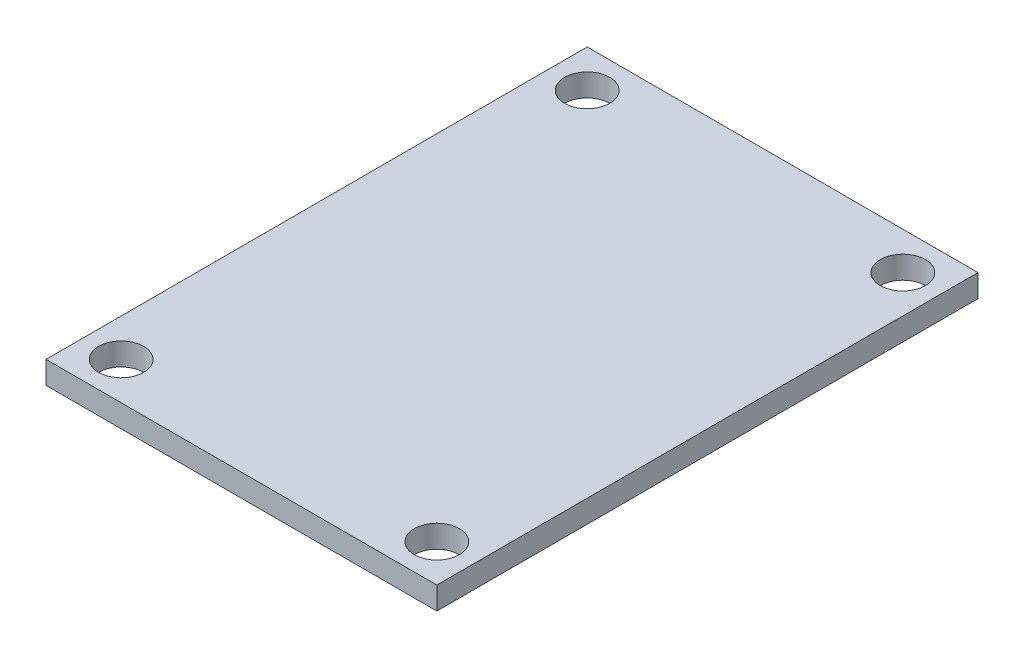
from build123d import *

# Parameters (mm, degrees)
SKETCH1_W           = 26
SKETCH1_H           = 36
BOSS_EXTRUDE1_DEPTH = 1.5
SKETCH2_R           = 1.5
CUT_EXTRUDE1_DEPTH  = 1.5
SKETCH5_W           = 15
SKETCH5_H           = 11.5
BOSS_EXTRUDE4_DEPTH = 2.5
SKETCH6_W           = 1.833556109
SKETCH6_H           = 1.290280226
SKETCH6_W_2         = 1.969375081
SKETCH6_W_3         = 1.697737138
SKETCH6_W_4         = 1.561918168
BOSS_EXTRUDE5_DEPTH = 1.5
FILLET1_R           = 0.5
CUT_EXTRUDE2_DEPTH  = 0.5


with BuildPart() as part:
    # Sketch1 → Boss-Extrude1 (new body)
    with BuildSketch(Plane(origin=(0, 0, 0), x_dir=(1, 0, 0), z_dir=(0, 1, 0))):
        Rectangle(SKETCH1_W, SKETCH1_H)
    extrude(amount=BOSS_EXTRUDE1_DEPTH)

    # Sketch2 → Cut-Extrude1 (cut)
    with BuildSketch(Plane(origin=(0, 1.5, 0), x_dir=(1, 0, 0), z_dir=(0, 1, 0))):
        with Locations((-10.5, 15.5)):
            Circle(SKETCH2_R)
        with Locations((10.5, 15.5)):
            Circle(SKETCH2_R)
        with Locations((10.5, -15.5)):
            Circle(SKETCH2_R)
        with Locations((-10.5, -15.5)):
            Circle(SKETCH2_R)
    extrude(amount=-CUT_EXTRUDE1_DEPTH, mode=Mode.SUBTRACT)

    # Sketch5 → Boss-Extrude4 (add)
    with BuildSketch(Plane.XZ):
        with Locations((0, 0.75)):
            Rectangle(SKETCH5_W, SKETCH5_H)
    extrude(amount=BOSS_EXTRUDE4_DEPTH)

    # Sketch6 → Boss-Extrude5 (add)
    with BuildSketch(Plane.XZ):
        with Locations((1.078775567, -11.02953631)):
            Rectangle(SKETCH6_W, SKETCH6_H)
        with Locations((3.455607561, -11.02953631)):
            Rectangle(SKETCH6_W_2, SKETCH6_H)
        with Locations((5.832439554, -11.02953631)):
            Rectangle(SKETCH6_W_3, SKETCH6_H)
        with Locations((8.039497834, -11.02953631)):
            Rectangle(SKETCH6_W_4, SKETCH6_H)
    extrude(amount=BOSS_EXTRUDE5_DEPTH)

    # Fillet1
    fillet1_edges = [part.edges().sort_by_distance(p)[0] for p in [
        (0, -2.5, -5),
        (-7.5, -2.5, 0.75),
        (0, -2.5, 6.5),
        (7.5, -2.5, 0.75),
    ]]
    fillet(fillet1_edges, radius=FILLET1_R)

    # Sketch7 → Cut-Extrude2 (cut)
    # profile 1 of 3: a face of its own
    with BuildSketch(Plane.XZ.offset(2.5)):
        with BuildLine():
            Line((-0.95224416, 1.042060188), (-1.221474929, 0.786851855))
            add(Edge.make_bspline(
                [(-1.221474929, 0.786851855), (-1.270193817, 0.832682718), (-1.366469864, 0.923251581), (-1.523430107, 1.040762576), (-1.687193741, 1.141428676), (-1.856906237, 1.223334912), (-2.028364791, 1.288687673), (-2.199293568, 1.335215813), (-2.367939269, 1.364888351), (-2.480106487, 1.36843672), (-2.535377173, 1.370185188)],
                knots=[0, 0, 0, 0, 1.08915593, 2.152340314, 3.188132944, 4.216796309, 5.218260357, 6.173443236, 7.099959455, 8, 8, 8, 8], degree=3))
            add(Edge.make_bspline(
                [(-2.535377173, 1.370185188), (-2.569291873, 1.369771582), (-2.637033313, 1.368945443), (-2.737655257, 1.358401228), (-2.837221894, 1.343236364), (-2.935545269, 1.321294486), (-3.032816556, 1.293485427), (-3.128697448, 1.258699963), (-3.223366803, 1.218144719), (-3.315932884, 1.171282245), (-3.405673387, 1.119802399), (-3.490430223, 1.062753858), (-3.570743622, 1.001965068), (-3.645104047, 0.935914089), (-3.713939234, 0.865199224), (-3.778887606, 0.791135918), (-3.837664901, 0.711700699), (-3.890756066, 0.628355073), (-3.938117685, 0.542562884), (-3.979926338, 0.455149894), (-4.015023426, 0.36640604), (-4.042792882, 0.276219962), (-4.065703536, 0.185289372), (-4.081821143, 0.092984652), (-4.090907865, -0.000793034), (-4.092479645, -0.063590292), (-4.093269801, -0.095159363)],
                knots=[0, 0, 0, 0, 1.02818874, 2.053710826, 3.065248034, 4.081641283, 5.106893873, 6.131558223, 7.173050175, 8.228653731, 9.27666206, 10.308777013, 11.325269123, 12.329503258, 13.32196095, 14.316845687, 15.314881793, 16.315733098, 17.311955233, 18.285320748, 19.252783886, 20.203351036, 21.145449891, 22.095197417, 23.042428769, 24, 24, 24, 24], degree=3))
            add(Edge.make_bspline(
                [(-4.093269801, -0.095159363), (-4.092514083, -0.12743018), (-4.09100471, -0.191883694), (-4.08134439, -0.288077767), (-4.06341615, -0.382843169), (-4.039448441, -0.476491302), (-4.009467625, -0.56918255), (-3.972094959, -0.66051506), (-3.927829359, -0.750485451), (-3.876592807, -0.838283068), (-3.820406603, -0.923806091), (-3.757463522, -1.004365613), (-3.690602939, -1.08103439), (-3.617389039, -1.152110154), (-3.540169497, -1.21949405), (-3.456637221, -1.281329572), (-3.36843476, -1.338807796), (-3.275427548, -1.391204315), (-3.178624766, -1.438012851), (-3.079368013, -1.479636747), (-2.977340197, -1.513916084), (-2.873077508, -1.541854188), (-2.766704236, -1.564754485), (-2.657680433, -1.579486966), (-2.546807725, -1.590177797), (-2.472069093, -1.590959467), (-2.434415634, -1.591353273)],
                knots=[0, 0, 0, 0, 0.93586088, 1.869166235, 2.799637598, 3.729985548, 4.670839027, 5.622275134, 6.589130586, 7.576015415, 8.568469353, 9.55398029, 10.53834874, 11.515998671, 12.510579167, 13.508179873, 14.527009472, 15.561807829, 16.601455013, 17.643573243, 18.680854198, 19.719860599, 20.772568776, 21.833555941, 22.908541556, 24, 24, 24, 24], degree=3))
            add(Edge.make_bspline(
                [(-2.434415634, -1.591353273), (-2.389037287, -1.590404697), (-2.29992953, -1.588542013), (-2.168943087, -1.574041724), (-2.043140016, -1.55139493), (-1.922873813, -1.518229034), (-1.808004792, -1.475925359), (-1.698111851, -1.424929972), (-1.594060192, -1.363286913), (-1.495537019, -1.293713046), (-1.404779833, -1.216198214), (-1.322925709, -1.132553758), (-1.25128022, -1.043185692), (-1.188775521, -0.948620376), (-1.137066867, -0.848075071), (-1.094624071, -0.742042509), (-1.06209078, -0.630474997), (-1.048735805, -0.553383365), (-1.04198775, -0.514430197)],
                knots=[0, 0, 0, 0, 1.13008108, 2.219097802, 3.278683437, 4.311054135, 5.322181354, 6.324827112, 7.324222904, 8.330512327, 9.32562643, 10.293043162, 11.24128371, 12.174520618, 13.111833804, 14.052305215, 15.015860969, 16, 16, 16, 16], degree=3))
            Line((-1.04198775, -0.514430197), (-2.208654416, -0.514430197))
            Line((-2.208654416, -0.514430197), (-2.208654416, -0.155455838))
            Line((-2.208654416, -0.155455838), (-0.727885186, -0.155455838))
            add(Edge.make_bspline(
                [(-0.727885186, -0.155455838), (-0.729591034, -0.222363326), (-0.732929687, -0.353313368), (-0.756348603, -0.544283639), (-0.794165115, -0.724655332), (-0.845825427, -0.894618404), (-0.912700708, -1.053931997), (-0.994073236, -1.202757863), (-1.091245357, -1.340134544), (-1.200755799, -1.467183547), (-1.323655756, -1.58051276), (-1.456624376, -1.680118697), (-1.599881345, -1.764021313), (-1.753291152, -1.832281975), (-1.916351586, -1.88555597), (-2.089439965, -1.923327547), (-2.272321566, -1.94595751), (-2.397658243, -1.94884889), (-2.461759384, -1.950327632)],
                knots=[0, 0, 0, 0, 1.140356446, 2.231883559, 3.274166699, 4.278491846, 5.25512956, 6.21435461, 7.1637429, 8.11826594, 9.068280886, 10.0076534, 10.945064095, 11.891975133, 12.864533718, 13.863980011, 14.907571808, 16, 16, 16, 16], degree=3))
            add(Edge.make_bspline(
                [(-2.461759384, -1.950327632), (-2.50126952, -1.949758511), (-2.579196241, -1.948636021), (-2.694287169, -1.940658673), (-2.806204789, -1.928378097), (-2.914932798, -1.909832974), (-3.02087114, -1.887118319), (-3.123490725, -1.858031601), (-3.223182467, -1.824362901), (-3.320100453, -1.786067228), (-3.413365, -1.741695571), (-3.503391517, -1.692385932), (-3.590677642, -1.638392571), (-3.674628807, -1.578781725), (-3.755682429, -1.513999265), (-3.833315872, -1.443915346), (-3.907963751, -1.368744226), (-3.954724214, -1.315365217), (-3.978285827, -1.288468658)],
                knots=[0, 0, 0, 0, 1.107784379, 2.184907829, 3.233506516, 4.263428166, 5.276301166, 6.270063455, 7.25232949, 8.225834625, 9.190232166, 10.146266622, 11.1027726, 12.066435141, 13.031522626, 14.010570082, 14.99756817, 16, 16, 16, 16], degree=3))
            add(Edge.make_bspline(
                [(-3.978285827, -1.288468658), (-4.012471759, -1.245798005), (-4.080276171, -1.161164988), (-4.167554328, -1.025565043), (-4.241955731, -0.885163183), (-4.302323553, -0.739568555), (-4.349461639, -0.588917342), (-4.383267892, -0.433402051), (-4.403075181, -0.27282242), (-4.405928719, -0.164157156), (-4.407372365, -0.109181799)],
                knots=[0, 0, 0, 0, 1.023165419, 2.029347347, 3.013907458, 3.994755782, 4.975994455, 5.96558838, 6.970761222, 8, 8, 8, 8], degree=3))
            add(Edge.make_bspline(
                [(-4.407372365, -0.109181799), (-4.406840127, -0.068015546), (-4.405782415, 0.013793761), (-4.392956899, 0.135251068), (-4.374555481, 0.254551761), (-4.347508426, 0.371598317), (-4.313412162, 0.486468909), (-4.270858676, 0.599216873), (-4.22131378, 0.709908744), (-4.163728284, 0.817782612), (-4.099643824, 0.921407025), (-4.030093604, 1.020364828), (-3.954090003, 1.112853893), (-3.872874204, 1.200045542), (-3.785477214, 1.280844389), (-3.69271779, 1.355998499), (-3.594524447, 1.425608685), (-3.490588267, 1.48857852), (-3.382460583, 1.54514214), (-3.270400581, 1.594731352), (-3.15444247, 1.635714667), (-3.035454993, 1.670488447), (-2.912537492, 1.696203588), (-2.786581955, 1.714852333), (-2.656931843, 1.727612933), (-2.569295814, 1.728639188), (-2.524860346, 1.729159547)],
                knots=[0, 0, 0, 0, 1.008945113, 2.00506715, 2.99143336, 3.967273523, 4.948097931, 5.927297278, 6.919902385, 7.919676788, 8.923139349, 9.905703106, 10.883022732, 11.856032218, 12.825136022, 13.798837087, 14.781400844, 15.773989409, 16.776158564, 17.77167057, 18.775803737, 19.789618931, 20.80898985, 21.851988756, 22.910860228, 24, 24, 24, 24], degree=3))
            add(Edge.make_bspline(
                [(-2.524860346, 1.729159547), (-2.488622102, 1.728580055), (-2.416765923, 1.727430991), (-2.309840191, 1.719466343), (-2.204567177, 1.706842462), (-2.100790787, 1.689615675), (-1.99886442, 1.666151985), (-1.898497715, 1.6380737), (-1.799545179, 1.605381878), (-1.70231693, 1.566393031), (-1.606159214, 1.522139406), (-1.510537373, 1.472325984), (-1.415778127, 1.416100979), (-1.321717146, 1.353297444), (-1.227761288, 1.284994026), (-1.135396645, 1.209237202), (-1.042393701, 1.129014447), (-0.982591887, 1.071332263), (-0.95224416, 1.042060188)],
                knots=[0, 0, 0, 0, 0.985871117, 1.954866573, 2.915460327, 3.869826059, 4.81536089, 5.759505086, 6.70452669, 7.649098992, 8.607881297, 9.583363685, 10.581137262, 11.603961102, 12.659522466, 13.73993555, 14.853081303, 16, 16, 16, 16], degree=3))
        make_face()
    # profile 2 of 3: a face of its own
    with BuildSketch(Plane.XZ.offset(2.5)):
        with BuildLine():
            Line((-0.009936468, 1.639415957), (0.676461769, 1.639415957))
            add(Edge.make_bspline(
                [(0.676461769, 1.639415957), (0.723672676, 1.639364061), (0.814130868, 1.639264626), (0.943845924, 1.63624988), (1.061655656, 1.632223188), (1.167306037, 1.626641294), (1.261122135, 1.620044704), (1.342679434, 1.610792665), (1.412618991, 1.601132369), (1.45452544, 1.591310963), (1.47363725, 1.586831823)],
                knots=[0, 0, 0, 0, 1.415646017, 2.712440637, 3.8905458, 4.950247383, 5.884950622, 6.709939814, 7.411656543, 8, 8, 8, 8], degree=3))
            add(Edge.make_bspline(
                [(1.47363725, 1.586831823), (1.497830784, 1.580209873), (1.545647761, 1.567122011), (1.614548804, 1.540908288), (1.68010265, 1.509826123), (1.742534208, 1.474402183), (1.801076291, 1.433116618), (1.856602332, 1.387643001), (1.908622313, 1.336931432), (1.956843705, 1.281550692), (2.001128502, 1.222430482), (2.039258185, 1.158688253), (2.071185412, 1.091396949), (2.098568683, 1.020603378), (2.118277138, 0.945713054), (2.133124038, 0.867246342), (2.142547665, 0.785211652), (2.143450227, 0.729151784), (2.143909686, 0.700613874)],
                knots=[0, 0, 0, 0, 0.999701418, 1.975846123, 2.934577507, 3.890451536, 4.834027766, 5.787354733, 6.749476667, 7.726910423, 8.712836071, 9.690891519, 10.682875813, 11.679750201, 12.712814741, 13.765529915, 14.8625177, 16, 16, 16, 16], degree=3))
            add(Edge.make_bspline(
                [(2.143909686, 0.700613874), (2.143488261, 0.671836097), (2.142663715, 0.615530433), (2.13276743, 0.533157645), (2.119437239, 0.454439255), (2.098940186, 0.379549804), (2.072094513, 0.308934034), (2.04060246, 0.241512802), (2.00261893, 0.17843313), (1.9589741, 0.119466013), (1.910422506, 0.0645561), (1.857169568, 0.014101306), (1.799430275, -0.031603033), (1.737388127, -0.072659376), (1.670438278, -0.108115656), (1.599596125, -0.139872961), (1.524245908, -0.166544021), (1.472103394, -0.180574083), (1.445592378, -0.18770744)],
                knots=[0, 0, 0, 0, 1.121902311, 2.195077645, 3.232258892, 4.234102512, 5.217864754, 6.176164875, 7.132989551, 8.084763148, 9.034132444, 9.988522005, 10.94243251, 11.903244335, 12.886203696, 13.894208494, 14.929344452, 16, 16, 16, 16], degree=3))
            add(Edge.make_bspline(
                [(1.445592378, -0.18770744), (1.423665044, -0.192370421), (1.375610017, -0.202589615), (1.296467295, -0.213998072), (1.204321909, -0.223735673), (1.099299629, -0.23103681), (0.981494724, -0.237287179), (0.850843467, -0.242255273), (0.70708939, -0.244985127), (0.606818146, -0.245125919), (0.554466577, -0.245199427)],
                knots=[0, 0, 0, 0, 0.601384939, 1.31797006, 2.144135048, 3.087295005, 4.142315834, 5.309527816, 6.595305764, 8, 8, 8, 8], degree=3))
            Line((0.554466577, -0.245199427), (0.304166096, -0.245199427))
            Line((0.304166096, -0.245199427), (0.304166096, -1.860584043))
            Line((0.304166096, -1.860584043), (-0.009936468, -1.860584043))
            Line((-0.009936468, -1.860584043), (-0.009936468, 1.639415957))
        make_face()
        with BuildLine():
            Line((0.304166096, 1.280441598), (0.304166096, 0.113774932))
            Line((0.304166096, 0.113774932), (0.916946545, 0.106062592))
            add(Edge.make_bspline(
                [(0.916946545, 0.106062592), (0.946866471, 0.106047128), (1.004626271, 0.106017276), (1.088062494, 0.1100025), (1.165471781, 0.114603032), (1.236616357, 0.121338956), (1.301528291, 0.130860213), (1.36031582, 0.140471951), (1.412523103, 0.154377314), (1.473622305, 0.173100383), (1.541705652, 0.205032999), (1.615773201, 0.251382889), (1.678543787, 0.310463597), (1.732862084, 0.376891428), (1.775967962, 0.450790558), (1.807523954, 0.529859494), (1.826065112, 0.613287344), (1.828551305, 0.670375483), (1.829807122, 0.69921163)],
                knots=[0, 0, 0, 0, 1.160613943, 2.240541288, 3.23993089, 4.169200891, 5.011653406, 5.7853311, 6.478053781, 7.106038997, 8.262395093, 9.384106736, 10.481365981, 11.59014053, 12.70357646, 13.786202915, 14.881775077, 16, 16, 16, 16], degree=3))
            add(Edge.make_bspline(
                [(1.829807122, 0.69921163), (1.828544476, 0.727350144), (1.826034491, 0.783286026), (1.807378627, 0.865264787), (1.776029314, 0.943500491), (1.732572719, 1.016473576), (1.679831589, 1.08266238), (1.618532246, 1.140159507), (1.548818985, 1.18638121), (1.483970754, 1.216214492), (1.426369568, 1.234429767), (1.376337608, 1.247174608), (1.319846933, 1.257350214), (1.256879154, 1.265589717), (1.18792232, 1.272643178), (1.112384005, 1.277429155), (1.030550362, 1.280230611), (0.973739791, 1.280369567), (0.944290295, 1.280441598)],
                knots=[0, 0, 0, 0, 1.120700087, 2.227813068, 3.331159281, 4.466773991, 5.599788987, 6.693661531, 7.80175334, 8.91857717, 9.525282508, 10.207424825, 10.974604443, 11.810962634, 12.737642355, 13.736264703, 14.826523623, 16, 16, 16, 16], degree=3))
            Line((0.944290295, 1.280441598), (0.304166096, 1.280441598))
        make_face(mode=Mode.SUBTRACT)
    # profile 3 of 3: a face of its own
    with BuildSketch(Plane.XZ.offset(2.5)):
        with BuildLine():
            Line((2.502884045, -1.185403754), (2.798757443, -1.00801994))
            add(Edge.make_bspline(
                [(2.798757443, -1.00801994), (2.82627568, -1.054084325), (2.87899956, -1.142341909), (2.96695092, -1.261599949), (3.058083831, -1.362962106), (3.153073164, -1.445838714), (3.251339112, -1.5110876), (3.353523166, -1.557289832), (3.459280977, -1.586105808), (3.531254798, -1.589605894), (3.56718693, -1.591353273)],
                knots=[0, 0, 0, 0, 1.272034388, 2.437168799, 3.508375237, 4.49857839, 5.41946034, 6.295179144, 7.148887113, 8, 8, 8, 8], degree=3))
            add(Edge.make_bspline(
                [(3.56718693, -1.591353273), (3.59787379, -1.590498601), (3.658710563, -1.588804211), (3.748272806, -1.572523409), (3.835254609, -1.54751128), (3.917863246, -1.511690348), (3.994958861, -1.468351862), (4.062565556, -1.416005685), (4.121011669, -1.357399479), (4.168820784, -1.292016825), (4.205500819, -1.221699676), (4.233692888, -1.149523725), (4.249337961, -1.074355156), (4.251694715, -1.023744694), (4.252884045, -0.998204235)],
                knots=[0, 0, 0, 0, 1.095163259, 2.171163733, 3.241058638, 4.321873601, 5.38011039, 6.391990106, 7.366004449, 8.327778327, 9.272591725, 10.192022065, 11.087607919, 12, 12, 12, 12], degree=3))
            add(Edge.make_bspline(
                [(4.252884045, -0.998204235), (4.251409734, -0.969063385), (4.248412676, -0.909824296), (4.223081196, -0.822424643), (4.183231949, -0.735932073), (4.146469306, -0.682430808), (4.127383244, -0.654654556)],
                knots=[0, 0, 0, 0, 0.938893495, 1.908633276, 2.914225137, 4, 4, 4, 4], degree=3))
            add(Edge.make_bspline(
                [(4.127383244, -0.654654556), (4.11171263, -0.634607732), (4.078814135, -0.592521933), (4.022256623, -0.529876698), (3.955890508, -0.465258279), (3.881986954, -0.396199222), (3.797853865, -0.325911425), (3.70612635, -0.251043147), (3.604462491, -0.17444157), (3.533162995, -0.123069005), (3.496373628, -0.096561607)],
                knots=[0, 0, 0, 0, 0.722233717, 1.516239348, 2.393582979, 3.351407094, 4.387010283, 5.505090956, 6.712668013, 8, 8, 8, 8], degree=3))
            add(Edge.make_bspline(
                [(3.496373628, -0.096561607), (3.459549632, -0.070333019), (3.389144956, -0.020185957), (3.290686373, 0.054238327), (3.20264191, 0.122282197), (3.125402894, 0.184586209), (3.059003297, 0.241158813), (3.002919886, 0.291456753), (2.958581329, 0.336840313), (2.933925748, 0.366281655), (2.922856, 0.379500092)],
                knots=[0, 0, 0, 0, 1.452282411, 2.77665338, 3.964542531, 5.026858415, 5.96415736, 6.766646006, 7.446254459, 8, 8, 8, 8], degree=3))
            add(Edge.make_bspline(
                [(2.922856, 0.379500092), (2.907383455, 0.400101129), (2.876954618, 0.440615833), (2.836788613, 0.50394069), (2.80264945, 0.568763956), (2.775887118, 0.63525982), (2.753350899, 0.702494749), (2.738192968, 0.771345995), (2.728701571, 0.841504613), (2.727729585, 0.888718114), (2.727243019, 0.912352656)],
                knots=[0, 0, 0, 0, 1.068054152, 2.10047183, 3.106115577, 4.101338837, 5.06977816, 6.043150881, 7.020423561, 8, 8, 8, 8], degree=3))
            add(Edge.make_bspline(
                [(2.727243019, 0.912352656), (2.728548228, 0.949382431), (2.731130749, 1.022650494), (2.752971266, 1.129681325), (2.787444159, 1.231867742), (2.835739047, 1.328198076), (2.8979964, 1.416164057), (2.970042375, 1.496777544), (3.055853861, 1.564546126), (3.150006484, 1.623758184), (3.253062856, 1.670104109), (3.36105376, 1.70506509), (3.474150832, 1.724874347), (3.550753966, 1.727717112), (3.589622827, 1.729159547)],
                knots=[0, 0, 0, 0, 1.005424448, 1.989358655, 2.955360095, 3.929531133, 4.905563448, 5.876582895, 6.856512386, 7.866279853, 8.892233794, 9.918561126, 10.94386622, 12, 12, 12, 12], degree=3))
            add(Edge.make_bspline(
                [(3.589622827, 1.729159547), (3.630866927, 1.727736995), (3.712888279, 1.724907994), (3.833537495, 1.700310463), (3.949698211, 1.659609791), (4.043141476, 1.613421133), (4.116274237, 1.567289718), (4.17204697, 1.525269893), (4.228564421, 1.476894785), (4.286282476, 1.422035539), (4.344223135, 1.360188787), (4.403246587, 1.291778099), (4.463490856, 1.217221543), (4.502246716, 1.163997042), (4.522114814, 1.13671163)],
                knots=[0, 0, 0, 0, 1.286793592, 2.559021753, 3.825965368, 5.121522368, 5.803751409, 6.523245864, 7.299691795, 8.125521123, 9.008227632, 9.944561021, 10.946284179, 12, 12, 12, 12], degree=3))
            Line((4.522114814, 1.13671163), (4.238160487, 0.921467239))
            add(Edge.make_bspline(
                [(4.238160487, 0.921467239), (4.221014555, 0.94355593), (4.187995498, 0.986093583), (4.137866011, 1.045664899), (4.090617363, 1.100081378), (4.044066963, 1.147346506), (4.000673332, 1.19004864), (3.95855629, 1.226608396), (3.918321938, 1.257383992), (3.867605028, 1.290227552), (3.803887309, 1.322784055), (3.723902773, 1.350333133), (3.640316498, 1.366888195), (3.583386867, 1.369077083), (3.554566737, 1.370185188)],
                knots=[0, 0, 0, 0, 1.181633172, 2.275549214, 3.290209073, 4.226197932, 5.078386478, 5.862611352, 6.581680152, 7.217281963, 8.414376989, 9.595101626, 10.782541182, 12, 12, 12, 12], degree=3))
            add(Edge.make_bspline(
                [(3.554566737, 1.370185188), (3.518410215, 1.368973488), (3.448685768, 1.366636839), (3.349695532, 1.341116854), (3.260601606, 1.300934993), (3.184049041, 1.244620015), (3.120312064, 1.177899023), (3.074206606, 1.101120167), (3.046456441, 1.016337765), (3.043070161, 0.957196109), (3.041345584, 0.927076214)],
                knots=[0, 0, 0, 0, 1.14458467, 2.207223713, 3.21896685, 4.227309161, 5.202851033, 6.127160689, 7.046193047, 8, 8, 8, 8], degree=3))
            add(Edge.make_bspline(
                [(3.041345584, 0.927076214), (3.04173871, 0.908324735), (3.042525606, 0.870791116), (3.053500404, 0.815339694), (3.067599733, 0.760028354), (3.089942365, 0.705105772), (3.120787668, 0.649611412), (3.161292844, 0.592589675), (3.212306156, 0.533537966), (3.251383169, 0.495130592), (3.272014654, 0.474852656)],
                knots=[0, 0, 0, 0, 0.858281714, 1.717966888, 2.583508476, 3.4729293, 4.427298488, 5.488583878, 6.674047936, 8, 8, 8, 8], degree=3))
            add(Edge.make_bspline(
                [(3.272014654, 0.474852656), (3.279676027, 0.46801563), (3.297877694, 0.451772422), (3.331153619, 0.425180141), (3.375096418, 0.392377369), (3.428558619, 0.351790052), (3.492525981, 0.30470859), (3.567005537, 0.251734978), (3.65116707, 0.191149519), (3.710888985, 0.148791979), (3.742467378, 0.126395124)],
                knots=[0, 0, 0, 0, 0.420754252, 0.999615792, 1.744751191, 2.668019286, 3.750313428, 4.999500688, 6.413464383, 8, 8, 8, 8], degree=3))
            add(Edge.make_bspline(
                [(3.742467378, 0.126395124), (3.780453292, 0.098753764), (3.854007748, 0.045230103), (3.958665328, -0.035185577), (4.053559136, -0.113833346), (4.13902234, -0.190210953), (4.215899248, -0.263739046), (4.283336969, -0.335302226), (4.342022649, -0.404387799), (4.405201868, -0.492960375), (4.469759687, -0.601741459), (4.525201195, -0.735019698), (4.560159542, -0.868816018), (4.564731057, -0.958742855), (4.566986609, -1.003112088)],
                knots=[0, 0, 0, 0, 1.163667725, 2.253281268, 3.268753668, 4.215851969, 5.092017293, 5.902905408, 6.650798638, 7.335211899, 8.59617414, 9.77448103, 10.901945474, 12, 12, 12, 12], degree=3))
            add(Edge.make_bspline(
                [(4.566986609, -1.003112088), (4.566329471, -1.034490453), (4.565027956, -1.096637836), (4.550067042, -1.187892913), (4.528147377, -1.276523783), (4.495110143, -1.361434895), (4.454786985, -1.444179658), (4.403620737, -1.522587558), (4.344313052, -1.598393957), (4.276279287, -1.669577448), (4.201833385, -1.734923644), (4.12314969, -1.793052706), (4.040099417, -1.841521029), (3.953133101, -1.881071871), (3.862230764, -1.912005389), (3.76742298, -1.934418258), (3.668553469, -1.948173969), (3.601352987, -1.94960173), (3.56718693, -1.950327632)],
                knots=[0, 0, 0, 0, 0.983748083, 1.948392443, 2.894712957, 3.844097841, 4.80183111, 5.778335162, 6.776009319, 7.81870978, 8.863265674, 9.881300176, 10.883814829, 11.87499822, 12.874611388, 13.892143829, 14.928324115, 16, 16, 16, 16], degree=3))
            add(Edge.make_bspline(
                [(3.56718693, -1.950327632), (3.540751587, -1.949816451), (3.488213827, -1.948800525), (3.410504345, -1.939819245), (3.334364756, -1.927112141), (3.260750474, -1.906938071), (3.188713062, -1.882461094), (3.118565827, -1.852322762), (3.050274774, -1.81620556), (2.983457191, -1.774910536), (2.918283016, -1.726852791), (2.855363548, -1.670879295), (2.792634363, -1.60853379), (2.731946966, -1.538123226), (2.672073822, -1.460785144), (2.614195413, -1.37579596), (2.557113695, -1.283618606), (2.521298227, -1.218753521), (2.502884045, -1.185403754)],
                knots=[0, 0, 0, 0, 0.915332311, 1.819136955, 2.706846663, 3.586547465, 4.459518054, 5.340707479, 6.227863349, 7.133153174, 8.059268498, 9.028702269, 10.047606654, 11.120612155, 12.245963614, 13.433783089, 14.680604001, 16, 16, 16, 16], degree=3))
        make_face()
    extrude(amount=-CUT_EXTRUDE2_DEPTH, mode=Mode.SUBTRACT)


solid = part.part
